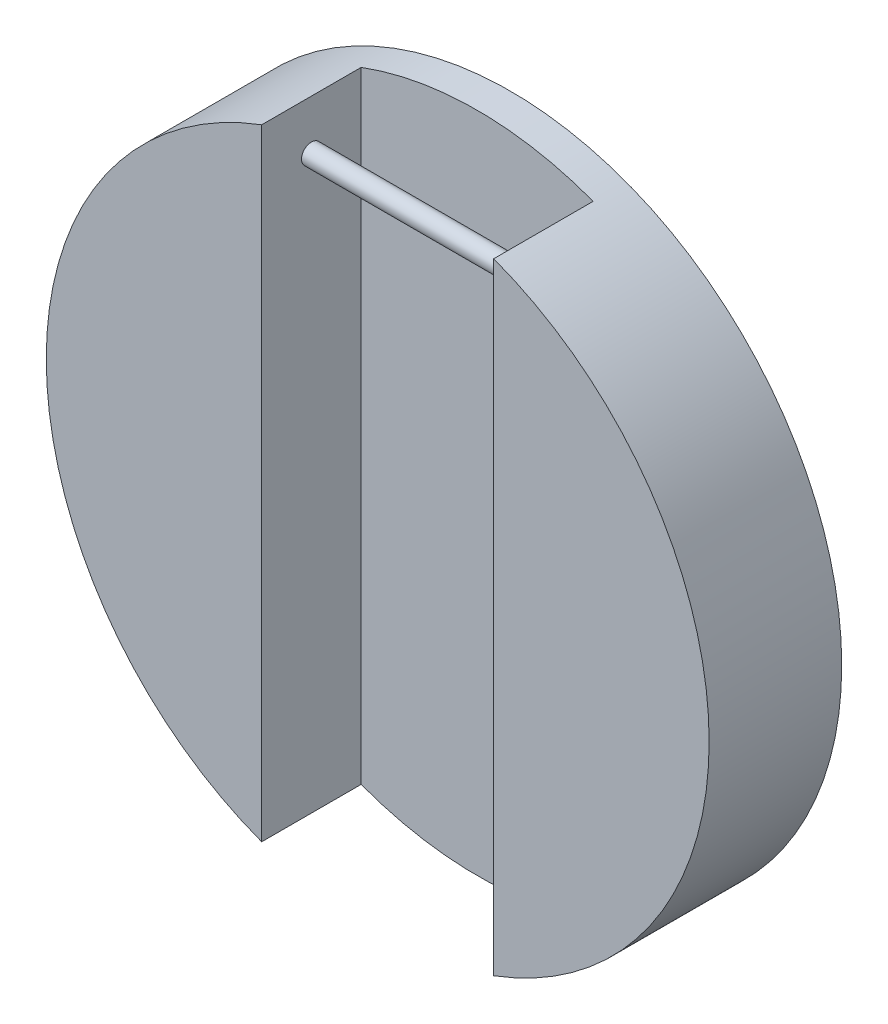
from build123d import *

# Parameters (mm, degrees)
SKETCH_2_R          = 100
EXTRUDE_1_DEPTH     = 40
CUT_EXTRUDE_1_DEPTH = 30
SKETCH_4_R          = 3
EXTRUDE_2_DEPTH     = 74


with BuildPart() as part:
    # 草图2 → 凸台-拉伸1 (new body)
    with BuildSketch(Plane.XY):
        Circle(SKETCH_2_R)
    extrude(amount=EXTRUDE_1_DEPTH)

    # 草图3 → 切除-拉伸1 (cut)
    with BuildSketch(Plane.XY.offset(40)):
        Polygon((0, -100), (35, -100), (35, 100), (-35, 100), (-35, -100), align=None)
    extrude(amount=-CUT_EXTRUDE_1_DEPTH, mode=Mode.SUBTRACT)

    # 草图4 → 凸台-拉伸2 (add)
    with BuildSketch(Plane(origin=(-35, 0, 0), x_dir=(0, 0, -1), z_dir=(1, 0, 0))):
        with Locations(Location((-25, 78.674969976, 0), (0, 0, 180))):
            Circle(SKETCH_4_R)
    extrude(amount=EXTRUDE_2_DEPTH)


solid = part.part
